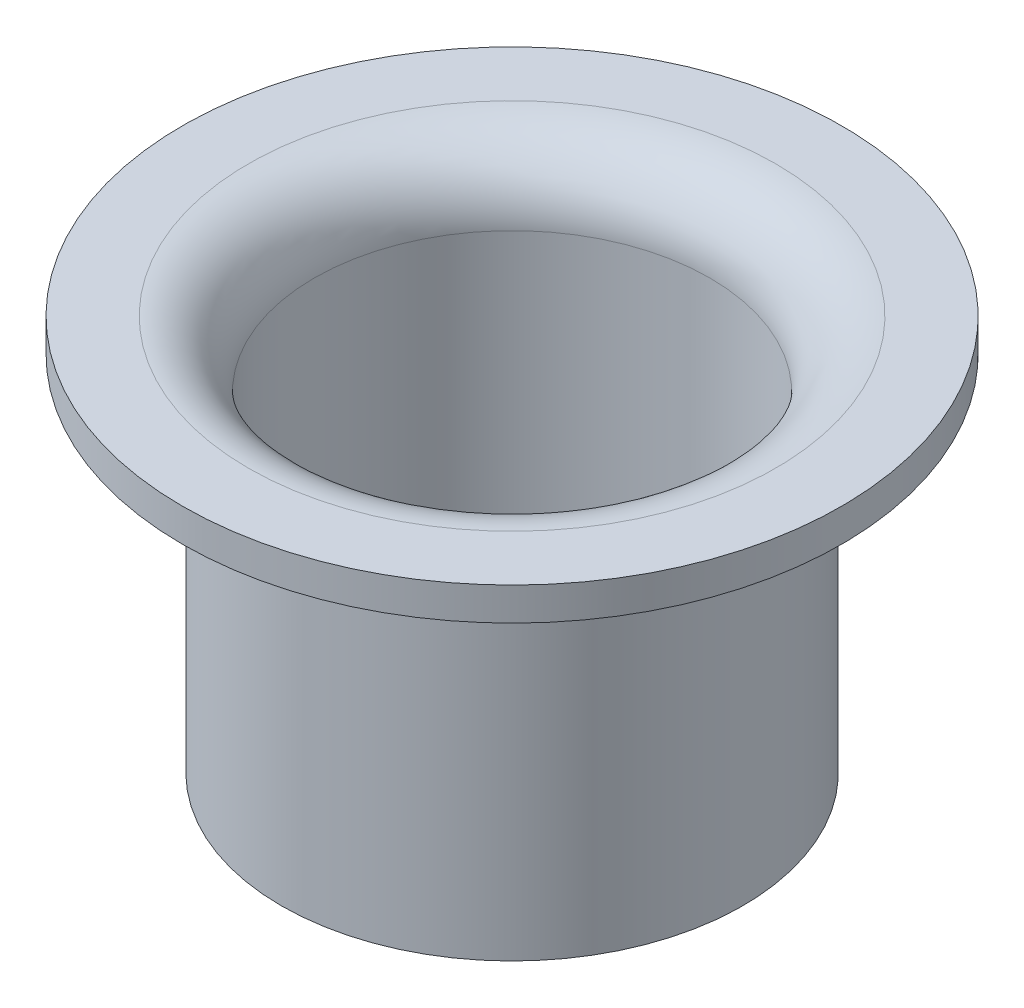
from build123d import *


with BuildPart() as part:
    # Skizze1 → Basis-Rotation (revolve)
    with BuildSketch(Plane.XY, mode=Mode.PRIVATE) as basis_rotation_sk:
        with BuildLine():
            Line((-6, -11), (-7, -11))
            Line((-7, -11), (-7, -1))
            ThreePointArc((-7, -1), (-7.292893219, -0.292893219), (-8, 0))
            Line((-8, 0), (-10, 0))
            Line((-10, 0), (-10, 1))
            Line((-10, 1), (-8, 1))
            ThreePointArc((-8, 1), (-6.585786438, 0.414213562), (-6, -1))
            Line((-6, -1), (-6, -11))
        make_face()
    revolve(basis_rotation_sk.sketch.rotate(Axis((0, 7.790971461, 0), (0, -1, 0)), 270), axis=Axis((0, 7.790971461, 0), (0, -1, 0)))


solid = part.part
